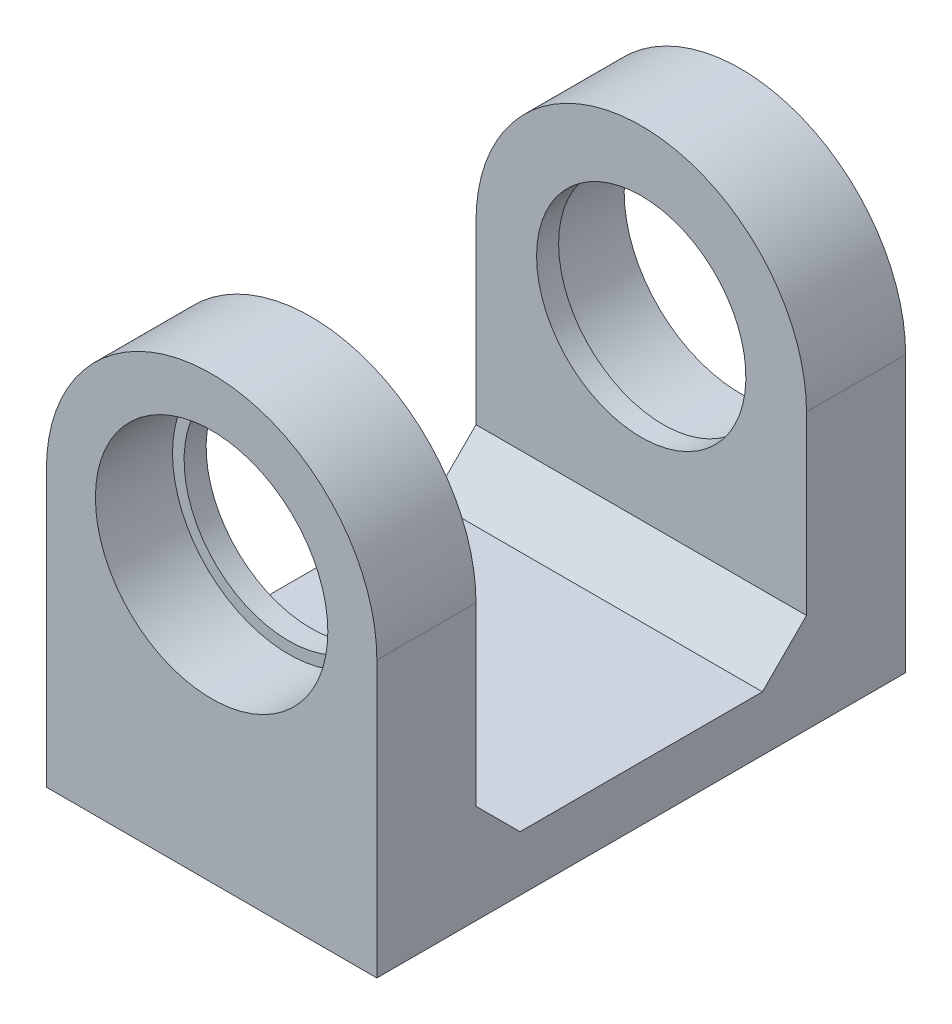
from build123d import *

# Parameters (mm, degrees)
SKETCH_1_R               = 9.5
EXTRUDE_1_DEPTH          = 24
CUT_EXTRUDE_1_DEPTH      = 38.762415177
CUT_EXTRUDE_1_DEPTH_BACK = 38.762415177
SKETCH_2_W               = 30
SKETCH_2_H               = 69.949963181
SKETCH_4_R               = 10.55
CUT_EXTRUDE_3_DEPTH      = 7
CHAMFER_2_SIZE           = 4
HOLE_WIZARD_M3_1_D       = 2.5
HOLE_WIZARD_M3_1_DEPTH   = 10
HOLE_WIZARD_M3_1_TIP     = 0.751075774


with BuildPart() as part:
    # 草图1 → 凸台-拉伸1 (new, symmetric)
    with BuildSketch(Plane.XY):
        with BuildLine():
            Line((-15, -25), (-15, 0))
            ThreePointArc((-15, 0), (0, 15), (15, 0))
            Line((15, 0), (15, -25))
            Line((15, -25), (-15, -25))
        make_face()
        Circle(SKETCH_1_R, mode=Mode.SUBTRACT)
    extrude(amount=EXTRUDE_1_DEPTH, both=True)

    # 草图2 → 切除-拉伸1 (cut, two sides: drawn at the far end of the back side and taken through both)
    with BuildSketch(Plane(origin=(0, 0, 0), x_dir=(0, 0, -1), z_dir=(1, 0, 0)).offset(-CUT_EXTRUDE_1_DEPTH_BACK)):
        with Locations((0, 14.974981591)):
            Rectangle(SKETCH_2_W, SKETCH_2_H)
    extrude(amount=CUT_EXTRUDE_1_DEPTH + CUT_EXTRUDE_1_DEPTH_BACK, mode=Mode.SUBTRACT)

    # 草图4 → 切除-拉伸3 (cut)
    with BuildSketch(Plane(origin=(0, 0, -24), x_dir=(-1, 0, 0), z_dir=(0, 0, -1))):
        Circle(SKETCH_4_R)
    cut_extrude_3 = extrude(amount=-CUT_EXTRUDE_3_DEPTH, mode=Mode.SUBTRACT)

    # 倒角2
    chamfer_2_edges = [part.edges().sort_by_distance(p)[0] for p in [
        (0, -20, 15),
        (0, -20, -15),
    ]]
    chamfer(chamfer_2_edges, length=CHAMFER_2_SIZE)

    # M3 螺纹孔1
    with Locations(Plane(origin=(0, -25, 0), x_dir=(-1, 0, 0), z_dir=(0, -1, 0))):
        with Locations((9, -19), (-9, -19), (9, 19), (-9, 19)):
            Hole(HOLE_WIZARD_M3_1_D / 2, depth=HOLE_WIZARD_M3_1_DEPTH)
            with Locations((0, 0, -(HOLE_WIZARD_M3_1_DEPTH + HOLE_WIZARD_M3_1_TIP / 2))):  # 118° drill point
                Cone(0, HOLE_WIZARD_M3_1_D / 2, HOLE_WIZARD_M3_1_TIP, mode=Mode.SUBTRACT)

    # 镜向1: 切除-拉伸3 across plane
    add(cut_extrude_3.mirror(Plane.XY), mode=Mode.SUBTRACT)


solid = part.part
